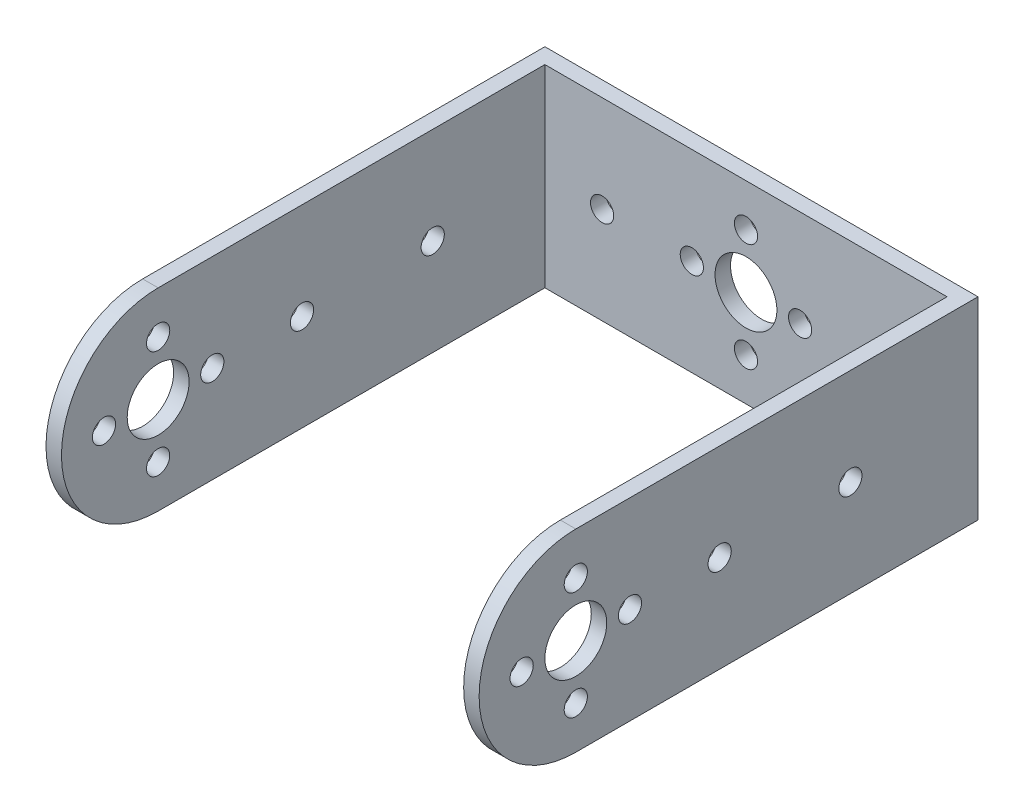
from build123d import *

# Parameters (mm, degrees)
SKETCH_1_W          = 56
SKETCH_1_H          = 25
EXTRUDE_1_DEPTH     = 64.5
CUT_EXTRUDE_1_DEPTH = 75.627407834
SKETCH_4_R          = 4
SKETCH_4_R_2        = 1.5
CUT_EXTRUDE_3_DEPTH = 70.616808315
CUT_EXTRUDE_4_DEPTH = 87.327863405
SKETCH_5_R          = 4
SKETCH_5_R_2        = 1.5
CUT_EXTRUDE_5_DEPTH = 87.327863405


with BuildPart() as part:
    # 草图1 → 凸台-拉伸1 (new body)
    with BuildSketch(Plane.XY):
        Rectangle(SKETCH_1_W, SKETCH_1_H)
    extrude(amount=EXTRUDE_1_DEPTH)

    # 草图2 → 切除-拉伸1 (cut, through all)
    with BuildSketch(Plane.XZ.offset(12.5)):
        Polygon((0, 64.5), (26, 64.5), (26, 2), (-26, 2), (-26, 64.5), align=None)
    extrude(amount=-CUT_EXTRUDE_1_DEPTH, mode=Mode.SUBTRACT)

    # 草图4 → 切除-拉伸3 (cut, through all)
    with BuildSketch(Plane.XY.offset(2)):
        Circle(SKETCH_4_R)
        with Locations((0, 7)):
            Circle(SKETCH_4_R_2)
        with Locations((0, -7)):
            Circle(SKETCH_4_R_2)
        with Locations((-7, 0)):
            Circle(SKETCH_4_R_2)
        with Locations((7, 0)):
            Circle(SKETCH_4_R_2)
        with Locations((18.6, 0)):
            Circle(SKETCH_4_R_2)
        with Locations(Location((-18.6, 0, 0), (0, 0, 180))):
            Circle(SKETCH_4_R_2)
    extrude(amount=-CUT_EXTRUDE_3_DEPTH, mode=Mode.SUBTRACT)

    # 草图3 → 切除-拉伸4 (cut, through all)
    with BuildSketch(Plane(origin=(28, 0, 0), x_dir=(0, 0, -1), z_dir=(1, 0, 0))):
        with BuildLine():
            ThreePointArc((-64.5, 0), (-60.838834765, 8.838834765), (-52, 12.5))
            Line((-52, 12.5), (-64.5, 12.5))
            Line((-64.5, 12.5), (-64.5, 0))
        make_face()
        with BuildLine():
            ThreePointArc((-52, -12.5), (-60.838834765, -8.838834765), (-64.5, 0))
            Line((-64.5, 0), (-64.5, -12.5))
            Line((-64.5, -12.5), (-52, -12.5))
        make_face()
    extrude(amount=-CUT_EXTRUDE_4_DEPTH, mode=Mode.SUBTRACT)

    # 草图5 → 切除-拉伸5 (cut, through all)
    with BuildSketch(Plane(origin=(28, 0, 0), x_dir=(0, 0, -1), z_dir=(1, 0, 0))):
        with Locations((-52, 0)):
            Circle(SKETCH_5_R)
        with Locations((-52, 7)):
            Circle(SKETCH_5_R_2)
        with Locations((-59, 0)):
            Circle(SKETCH_5_R_2)
        with Locations((-52, -7)):
            Circle(SKETCH_5_R_2)
        with Locations((-45, 0)):
            Circle(SKETCH_5_R_2)
        with Locations((-33.4, 0)):
            Circle(SKETCH_5_R_2)
        with Locations((-16.5, 0)):
            Circle(SKETCH_5_R_2)
    extrude(amount=-CUT_EXTRUDE_5_DEPTH, mode=Mode.SUBTRACT)


solid = part.part
